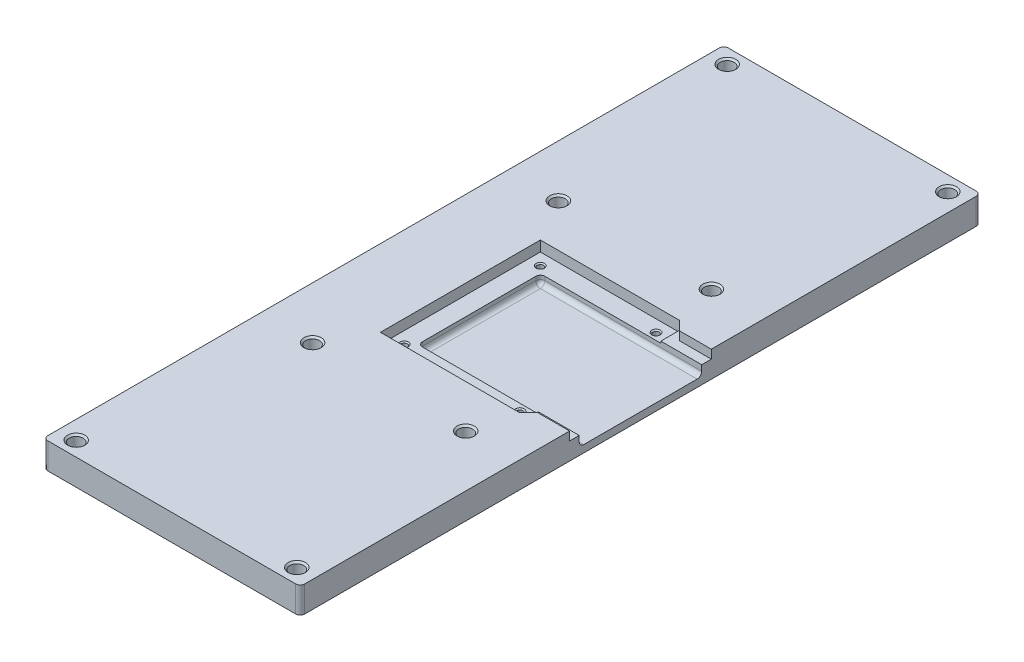
from build123d import *

# Parameters (mm, degrees)
BOSS_EXTRUDE1_DEPTH     = 11.5
SKETCH4_R               = 3.075
CUT_EXTRUDE1_DEPTH      = 6
CUT_EXTRUDE6_DEPTH      = 4.6
CUT_EXTRUDE3_DEPTH      = 161.480530361
CUT_EXTRUDE3_DEPTH_BACK = 3.7
SKETCH24_W              = 71.125
SKETCH24_H              = 54
SKETCH25_R              = 1.35
CUT_EXTRUDE4_DEPTH      = 5
CHAMFER4_SIZE           = 0.5
FILLET1_R               = 2
BOSS_EXTRUDE2_DEPTH     = 0.8
CHAMFER5_SIZE           = 0.75


with BuildPart() as part:
    # Sketch1 → Boss-Extrude1 (new body)
    with BuildSketch(Plane(origin=(0, 0, 0), x_dir=(1, 0, 0), z_dir=(0, 1, 0))):
        with BuildLine():
            Line((-56.625, 135), (-56.625, -135))
            Line((-56.625, -135), (-56.625, -148))
            ThreePointArc((-56.625, -148), (-56.039213562, -149.414213562), (-54.625, -150))
            Line((-54.625, -150), (54.625, -150))
            ThreePointArc((54.625, -150), (56.039213562, -149.414213562), (56.625, -148))
            Line((56.625, -148), (56.625, -135))
            Line((56.625, -135), (56.625, 135))
            Line((56.625, 135), (56.625, 148))
            ThreePointArc((56.625, 148), (56.039213562, 149.414213562), (54.625, 150))
            Line((54.625, 150), (-54.625, 150))
            ThreePointArc((-54.625, 150), (-56.039213562, 149.414213562), (-56.625, 148))
            Line((-56.625, 148), (-56.625, 135))
        make_face()
    extrude(amount=BOSS_EXTRUDE1_DEPTH)

    # Sketch4 → Cut-Extrude1 (cut)
    with BuildSketch(Plane(origin=(0, 11.5, 0), x_dir=(1, 0, 0), z_dir=(0, 1, 0))):
        with Locations(Location((-48.625, -143.5, 0), (0, 0, 270))):
            Circle(SKETCH4_R)
        with Locations(Location((48.625, -143.5, 0), (0, 0, 270))):
            Circle(SKETCH4_R)
        with Locations(Location((48.625, 143.5, 0), (0, 0, 270))):
            Circle(SKETCH4_R)
        with Locations(Location((-48.625, 143.5, 0), (0, 0, 270))):
            Circle(SKETCH4_R)
        with Locations(Location((-33.75, -54.175, 0), (0, 0, 270))):
            Circle(SKETCH4_R)
        with Locations(Location((33.75, -54.175, 0), (0, 0, 270))):
            Circle(SKETCH4_R)
        with Locations(Location((33.75, 54.175, 0), (0, 0, 270))):
            Circle(SKETCH4_R)
        with Locations(Location((-33.75, 54.175, 0), (0, 0, 270))):
            Circle(SKETCH4_R)
    extrude(amount=-CUT_EXTRUDE1_DEPTH, mode=Mode.SUBTRACT)

    # Sketch21 → Cut-Extrude6 (cut)
    with BuildSketch(Plane(origin=(0, 11.5, 0), x_dir=(1, 0, 0), z_dir=(0, 1, 0))):
        Polygon((56.625, 31), (56.625, -31), (56.625, -31.25), (42.603553391, -31.25), (38.603553391, -35.25), (-22.75, -35.25), (-22.75, 35.25), (38.603553391, 35.25), (42.603553391, 31.25), (56.625, 31.25), align=None)
    extrude(amount=-CUT_EXTRUDE6_DEPTH, mode=Mode.SUBTRACT)

    # Sketch24 → Cut-Extrude3 (cut, two sides: drawn at the far end of the back side and taken through both)
    with BuildSketch(Plane(origin=(0, 6.9, 0), x_dir=(1, 0, 0), z_dir=(0, 1, 0)).offset(-CUT_EXTRUDE3_DEPTH_BACK)):
        with Locations((21.0625, 0)):
            Rectangle(SKETCH24_W, SKETCH24_H)
    extrude(amount=CUT_EXTRUDE3_DEPTH + CUT_EXTRUDE3_DEPTH_BACK, mode=Mode.SUBTRACT)

    # Sketch25 → Cut-Extrude4 (cut)
    with BuildSketch(Plane(origin=(0, 6.9, 0), x_dir=(1, 0, 0), z_dir=(0, 1, 0))):
        with Locations(Location((33.5, 30, 0), (0, 0, 270))):
            Circle(SKETCH25_R)
        with Locations(Location((-17.5, 30, 0), (0, 0, 270))):
            Circle(SKETCH25_R)
        with Locations(Location((33.5, -30, 0), (0, 0, 270))):
            Circle(SKETCH25_R)
        with Locations(Location((-17.5, -30, 0), (0, 0, 270))):
            Circle(SKETCH25_R)
    extrude(amount=-CUT_EXTRUDE4_DEPTH, mode=Mode.SUBTRACT)

    # Chamfer4
    chamfer4_edges = [part.edges().sort_by_distance(p)[0] for p in [
        (-17.5, 6.9, -31.35),
        (33.5, 6.9, 28.65),
        (-17.5, 6.9, 28.65),
        (33.5, 6.9, -31.35),
    ]]
    chamfer(chamfer4_edges, length=CHAMFER4_SIZE)

    # Fillet1
    fillet1_edges = [part.edges().sort_by_distance(p)[0] for p in [
        (21.0625, 3.2, -27),
        (-14.5, 5.05, -27),
        (-14.5, 3.2, 0),
        (-14.5, 5.05, 27),
        (21.0625, 3.2, 27),
    ]]
    fillet(fillet1_edges, radius=FILLET1_R)

    # Sketch26 → Boss-Extrude2 (add)
    with BuildSketch(Plane(origin=(0, 6.9, 0), x_dir=(1, 0, 0), z_dir=(0, 1, 0))):
        Polygon((38.603553391, 35.25), (38.603553391, 27), (56.625, 27), (56.625, 31.25), (42.603553391, 31.25), align=None)
        Polygon((42.603553391, -31.25), (38.603553391, -35.25), (38.603553391, -27), (56.625, -27), (56.625, -31.25), align=None)
    extrude(amount=BOSS_EXTRUDE2_DEPTH)

    # Chamfer5
    chamfer5_edges = [part.edges().sort_by_distance(p)[0] for p in [
        (48.625, 11.5, 140.425),
        (48.625, 11.5, -146.575),
        (-33.75, 11.5, 51.1),
        (33.75, 11.5, 51.1),
        (-33.75, 11.5, -57.25),
        (33.75, 11.5, -57.25),
        (-48.625, 11.5, -146.575),
        (-48.625, 11.5, 140.425),
    ]]
    chamfer(chamfer5_edges, length=CHAMFER5_SIZE)


solid = part.part
